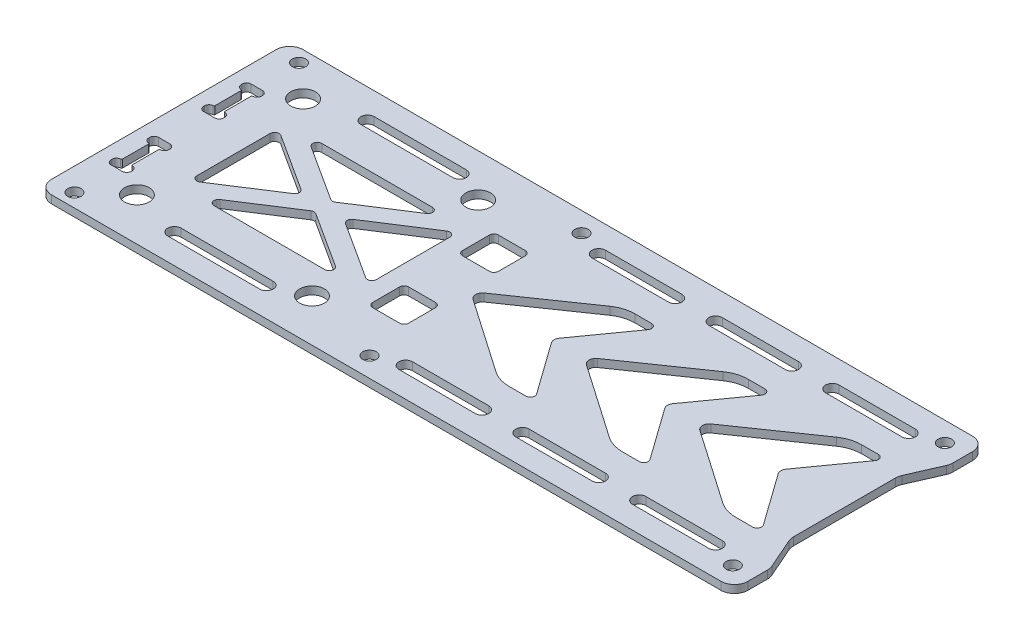
from build123d import *

# Parameters (mm, degrees)
SKETCH1_R           = 1.5
BOSS_EXTRUDE1_DEPTH = 1.75
SKETCH2_R           = 2.75
SKETCH2_W           = 8
SKETCH2_H           = 8
CUT_EXTRUDE2_DEPTH  = 162.47698509
FILLET1_R           = 3
FILLET2_R           = 3
FILLET3_R           = 1
FILLET4_R           = 1
FILLET5_R           = 1
FILLET6_R           = 7.5
FILLET7_R           = 1
FILLET8_R           = 1.5
FILLET9_R           = 1.5


with BuildPart() as part:
    # Sketch1 → Boss-Extrude1 (new body)
    with BuildSketch(Plane(origin=(0, 0, 0), x_dir=(1, 0, 0), z_dir=(0, 1, 0))):
        Polygon((-160.531217108, -17.363252791), (-160.531217108, 10.636747209), (-5.481217108, 10.636747209), (-5.481217108, 2.636747209), (-8.981217108, -5.363252791), (-8.981217108, -17.363252791), align=None)
        with Locations(Location((-155.431217108, 7.636747209, 0), (0, 0, 270))):
            Circle(SKETCH1_R, mode=Mode.SUBTRACT)
        with Locations(Location((-91.131217108, 6.236747209, 0), (0, 0, 270))):
            Circle(SKETCH1_R, mode=Mode.SUBTRACT)
        with Locations(Location((-10.231217108, 6.236747209, 0), (0, 0, 270))):
            Circle(SKETCH1_R, mode=Mode.SUBTRACT)
        with BuildLine():
            Line((-156.531217108, -4.209246371), (-156.531217108, -9.917259212))
            ThreePointArc((-156.531217108, -9.917259212), (-156.597505378, -10.086817462), (-156.761217108, -10.166457928))
            ThreePointArc((-156.761217108, -10.166457928), (-157.416064031, -10.485019793), (-157.681217108, -11.163252791))
            Line((-157.681217108, -11.163252791), (-157.681217108, -11.363252791))
            ThreePointArc((-157.681217108, -11.363252791), (-157.388323889, -12.070359573), (-156.681217108, -12.363252791))
            Line((-156.681217108, -12.363252791), (-154.181217108, -12.363252791))
            ThreePointArc((-154.181217108, -12.363252791), (-153.474110327, -12.070359573), (-153.181217108, -11.363252791))
            Line((-153.181217108, -11.363252791), (-153.181217108, -11.163252791))
            ThreePointArc((-153.181217108, -11.163252791), (-153.446370185, -10.485019793), (-154.101217108, -10.166457928))
            ThreePointArc((-154.101217108, -10.166457928), (-154.264928839, -10.086817462), (-154.331217108, -9.917259212))
            Line((-154.331217108, -9.917259212), (-154.331217108, -4.209246371))
            ThreePointArc((-154.331217108, -4.209246371), (-154.264928839, -4.039688121), (-154.101217108, -3.960047655))
            ThreePointArc((-154.101217108, -3.960047655), (-153.446370185, -3.64148579), (-153.181217108, -2.963252791))
            Line((-153.181217108, -2.963252791), (-153.181217108, -2.763252791))
            ThreePointArc((-153.181217108, -2.763252791), (-153.474110327, -2.05614601), (-154.181217108, -1.763252791))
            Line((-154.181217108, -1.763252791), (-156.681217108, -1.763252791))
            ThreePointArc((-156.681217108, -1.763252791), (-157.388323889, -2.05614601), (-157.681217108, -2.763252791))
            Line((-157.681217108, -2.763252791), (-157.681217108, -2.963252791))
            ThreePointArc((-157.681217108, -2.963252791), (-157.416064031, -3.64148579), (-156.761217108, -3.960047655))
            ThreePointArc((-156.761217108, -3.960047655), (-156.597505378, -4.039688121), (-156.531217108, -4.209246371))
        make_face(mode=Mode.SUBTRACT)
    extrude(amount=BOSS_EXTRUDE1_DEPTH)

    # Sketch2 → Cut-Extrude2 (cut, through all)
    with BuildSketch(Plane(origin=(0, 0, 0), x_dir=(1, 0, 0), z_dir=(0, 1, 0))):
        with Locations(Location((-148.031217108, 1.136747209, 0), (0, 0, 270))):
            Circle(SKETCH2_R)
        with Locations(Location((-109.031217108, 1.136747209, 0), (0, 0, 270))):
            Circle(SKETCH2_R)
        with BuildLine():
            Line((-59.181217108, 5.636747209), (-42.181217108, 5.636747209))
            ThreePointArc((-42.181217108, 5.636747209), (-40.681217108, 4.136747209), (-42.181217108, 2.636747209))
            Line((-42.181217108, 2.636747209), (-59.181217108, 2.636747209))
            ThreePointArc((-59.181217108, 2.636747209), (-60.681217108, 4.136747209), (-59.181217108, 5.636747209))
        make_face()
        with BuildLine():
            Line((-33.181217108, 5.636747209), (-16.181217108, 5.636747209))
            ThreePointArc((-16.181217108, 5.636747209), (-14.681217108, 4.136747209), (-16.181217108, 2.636747209))
            Line((-16.181217108, 2.636747209), (-33.181217108, 2.636747209))
            ThreePointArc((-33.181217108, 2.636747209), (-34.681217108, 4.136747209), (-33.181217108, 5.636747209))
        make_face()
        with BuildLine():
            Line((-85.181217108, 5.636747209), (-68.181217108, 5.636747209))
            ThreePointArc((-68.181217108, 5.636747209), (-66.681217108, 4.136747209), (-68.181217108, 2.636747209))
            Line((-68.181217108, 2.636747209), (-85.181217108, 2.636747209))
            ThreePointArc((-85.181217108, 2.636747209), (-86.681217108, 4.136747209), (-85.181217108, 5.636747209))
        make_face()
        with BuildLine():
            Line((-136.681217108, 5.636747209), (-116.181217108, 5.636747209))
            ThreePointArc((-116.181217108, 5.636747209), (-114.681217108, 4.136747209), (-116.181217108, 2.636747209))
            Line((-116.181217108, 2.636747209), (-136.681217108, 2.636747209))
            ThreePointArc((-136.681217108, 2.636747209), (-138.181217108, 4.136747209), (-136.681217108, 5.636747209))
        make_face()
        Polygon((-145.031217108, -17.363252791), (-145.031217108, -7.363252791), (-129.531217108, -17.363252791), align=None)
        Polygon((-120.531217108, -17.363252791), (-105.031217108, -17.363252791), (-105.031217108, -7.363252791), align=None)
        Polygon((-140.75287041, -5.363252791), (-109.309563807, -5.363252791), (-125.031217108, -15.506254922), align=None)
        Polygon((-23.481217108, -17.363252791), (-13.481217108, -3.363252791), (-21.481217108, -3.363252791), (-41.731217108, -17.363252791), align=None)
        with Locations((-97.031217108, -7.363252791)):
            Rectangle(SKETCH2_W, SKETCH2_H)
        Polygon((-46.731217108, -3.363252791), (-66.981217108, -17.363252791), (-48.731217108, -17.363252791), (-38.731217108, -3.363252791), align=None)
        Polygon((-71.981217108, -3.363252791), (-92.231217108, -17.363252791), (-73.981217108, -17.363252791), (-63.981217108, -3.363252791), align=None)
    extrude(amount=CUT_EXTRUDE2_DEPTH, mode=Mode.SUBTRACT)

    # Fillet1
    fillet1_edges = [part.edges().sort_by_distance(p)[0] for p in [
        (-160.531217108, 0.875, -10.636747209),
        (-5.481217108, 0.875, -10.636747209),
    ]]
    fillet(fillet1_edges, radius=FILLET1_R)

    # Fillet2
    fillet2_edges = [part.edges().sort_by_distance(p)[0] for p in [
        (-5.481217108, 0.875, -2.636747209),
        (-8.981217108, 0.875, 5.363252791),
    ]]
    fillet(fillet2_edges, radius=FILLET2_R)

    # Fillet3
    fillet3_edges = [part.edges().sort_by_distance(p)[0] for p in [
        (-101.031217108, 0.875, 3.363252791),
        (-101.031217108, 0.875, 11.363252791),
        (-93.031217108, 0.875, 11.363252791),
        (-93.031217108, 0.875, 3.363252791),
    ]]
    fillet(fillet3_edges, radius=FILLET3_R)

    # Fillet4
    fillet4_edges = [part.edges().sort_by_distance(p)[0] for p in [
        (-145.031217108, 0.875, 7.363252791),
        (-140.75287041, 0.875, 5.363252791),
        (-125.031217108, 0.875, 15.506254922),
        (-109.309563807, 0.875, 5.363252791),
        (-105.031217108, 0.875, 7.363252791),
    ]]
    fillet(fillet4_edges, radius=FILLET4_R)

    # Fillet5
    fillet5_edges = [part.edges().sort_by_distance(p)[0] for p in [
        (-38.731217108, 0.875, 3.363252791),
        (-63.981217108, 0.875, 3.363252791),
        (-13.481217108, 0.875, 3.363252791),
    ]]
    fillet(fillet5_edges, radius=FILLET5_R)

    # Fillet6
    fillet6_edges = [part.edges().sort_by_distance(p)[0] for p in [
        (-46.731217108, 0.875, 3.363252791),
        (-71.981217108, 0.875, 3.363252791),
        (-21.481217108, 0.875, 3.363252791),
    ]]
    fillet(fillet6_edges, radius=FILLET6_R)

    # Mirror1: part across plane


with BuildPart() as part_1:
    add(part.part)
    add(part.part.mirror(Plane(origin=(-8.981217108, 1.75, 17.363252791), x_dir=(1, 0, 0), z_dir=(0, 0, -1))))

    # Fillet7
    fillet7_edges = [part_1.edges().sort_by_distance(p)[0] for p in [
        (-120.531217108, 0.875, 17.363252791),
        (-129.531217108, 0.875, 17.363252791),
    ]]
    fillet(fillet7_edges, radius=FILLET7_R)

    # Fillet8
    fillet8_edges = [part_1.edges().sort_by_distance(p)[0] for p in [
        (-92.231217108, 0.875, 17.363252791),
        (-41.731217108, 0.875, 17.363252791),
        (-66.981217108, 0.875, 17.363252791),
    ]]
    fillet(fillet8_edges, radius=FILLET8_R)

    # Fillet9
    fillet9_edges = [part_1.edges().sort_by_distance(p)[0] for p in [
        (-23.481217108, 0.875, 17.363252791),
        (-73.981217108, 0.875, 17.363252791),
        (-48.731217108, 0.875, 17.363252791),
    ]]
    fillet(fillet9_edges, radius=FILLET9_R)


solid = part_1.part
